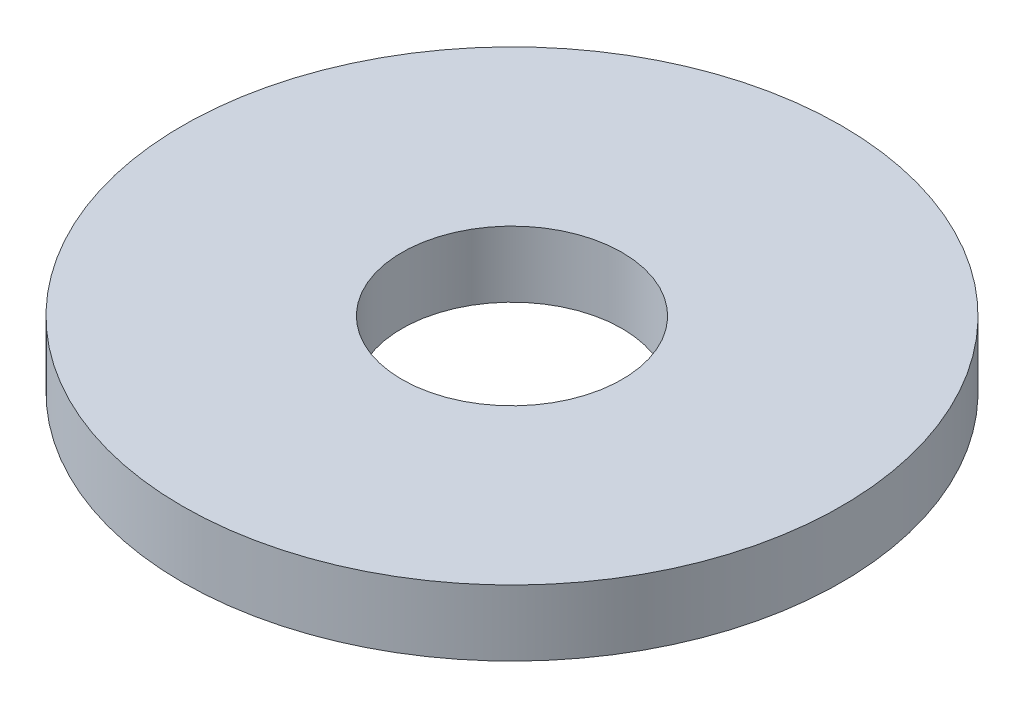
from build123d import *

# Parameters (mm, degrees)
SKETCH1_R           = 25
SKETCH1_R_2         = 8.35
BOSS_EXTRUDE1_DEPTH = 5


with BuildPart() as part:
    # Sketch1 → Boss-Extrude1 (new body)
    with BuildSketch(Plane(origin=(0, 0, 0), x_dir=(1, 0, 0), z_dir=(0, 1, 0))):
        with Locations(Location((0, 0, 0), (0, 0, 270))):
            Circle(SKETCH1_R)
        with Locations(Location((0, 0, 0), (0, 0, 270))):
            Circle(SKETCH1_R_2, mode=Mode.SUBTRACT)
    extrude(amount=BOSS_EXTRUDE1_DEPTH)


solid = part.part
